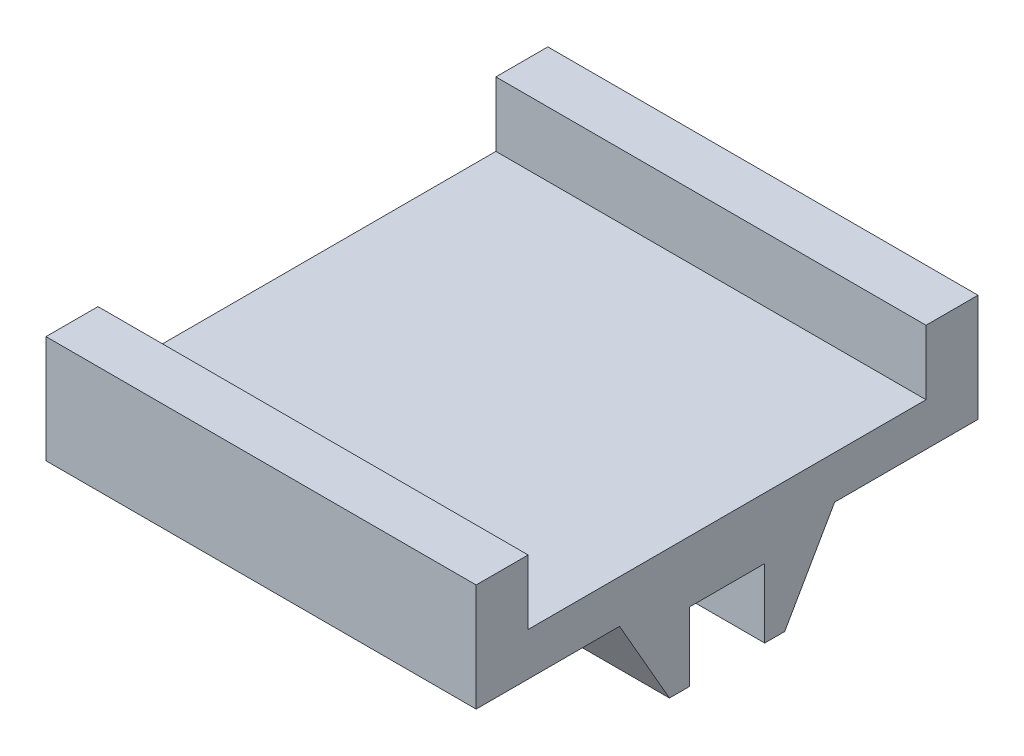
from build123d import *

# Parameters (mm, degrees)
SKETCH_2_W          = 60
SKETCH_2_H          = 70
EXTRUDE_1_DEPTH     = 15
SKETCH_7_W          = 55.5
SKETCH_7_H          = 9
CUT_EXTRUDE_3_DEPTH = 91.530456977
EXTRUDE_3_DEPTH     = 60


with BuildPart() as part:
    # 草图2 → 凸台-拉伸1 (new body)
    with BuildSketch(Plane(origin=(0, 0, 0), x_dir=(1, 0, 0), z_dir=(0, 1, 0))):
        with Locations((-4.452764977, 31.111751152)):
            Rectangle(SKETCH_2_W, SKETCH_2_H)
    extrude(amount=EXTRUDE_1_DEPTH)

    # 草图7 → 切除-拉伸3 (cut, through all)
    with BuildSketch(Plane.ZY.offset(34.452764977)):
        with Locations((-31.111751152, 10.5)):
            Rectangle(SKETCH_7_W, SKETCH_7_H)
    extrude(amount=-CUT_EXTRUDE_3_DEPTH, mode=Mode.SUBTRACT)

    # 草图8 → 凸台-拉伸3 (add)
    with BuildSketch(Plane.ZY.offset(34.452764977)):
        Polygon((-46.111751152, 0), (-16.111751152, 0), (-23.076751152, -12.144495667), (-25.861751152, -12.144495667), (-25.861751152, -2.537373778), (-36.361751152, -2.537373778), (-36.361751152, -12.144495667), (-39.146751152, -12.144495667), align=None)
    extrude(amount=-EXTRUDE_3_DEPTH)


solid = part.part
